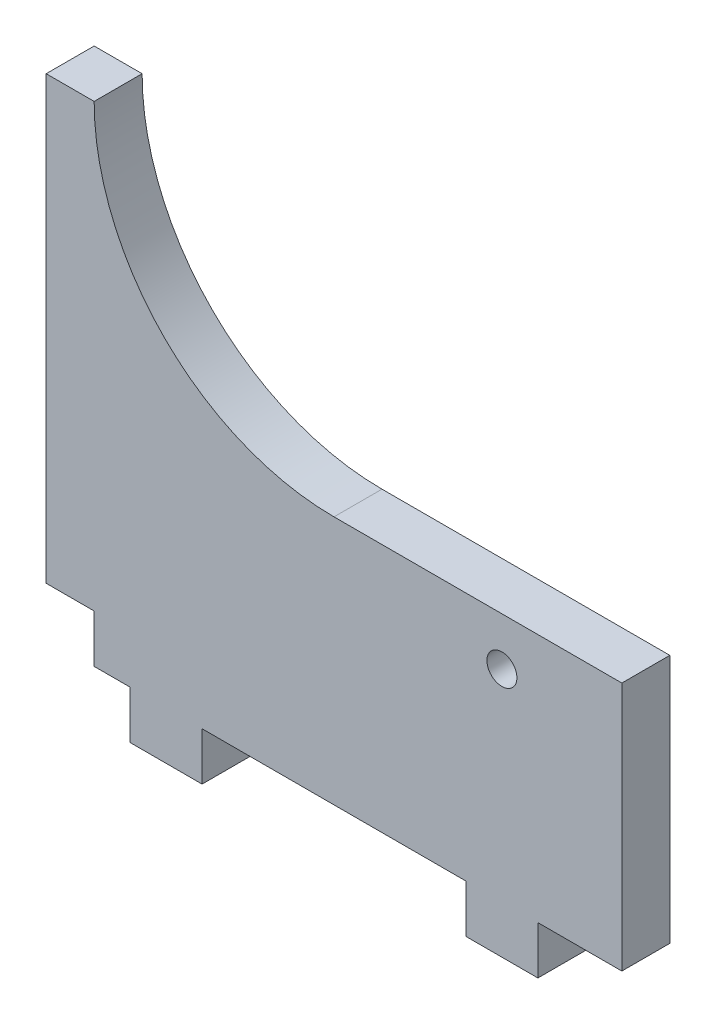
from build123d import *

# Parameters (mm, degrees)
EXTRUDE1_DEPTH     = 12.7
SKETCH2_R          = 3.96875
CUT_EXTRUDE1_DEPTH = 162.863978698
SKETCH3_W          = 12.7
SKETCH3_H          = 12.7
EXTRUDE2_DEPTH     = 162.863978698
SKETCH4_W          = 105.983052191
SKETCH4_H          = 75.202262717
EXTRUDE3_DEPTH     = 162.863978698


with BuildPart() as part:
    # Sketch1 → Extrude1 (new body)
    with BuildSketch(Plane.XY):
        with BuildLine():
            Line((-76.2, 12.7), (-53.975, 12.7))
            Line((-53.975, 12.7), (-53.975, 0))
            Line((-53.975, 0), (-34.925, 0))
            Line((-34.925, 0), (-34.925, 12.7))
            Line((-34.925, 12.7), (34.925, 12.7))
            Line((34.925, 12.7), (34.925, 0))
            Line((34.925, 0), (53.975, 0))
            Line((53.975, 0), (53.975, 12.7))
            Line((53.975, 12.7), (76.2, 12.7))
            Line((76.2, 12.7), (76.2, 142.24))
            Line((76.2, 142.24), (63.5, 142.24))
            ThreePointArc((63.5, 142.24), (0, 78.74), (-63.5, 142.24))
            Line((-63.5, 142.24), (-76.2, 142.24))
            Line((-76.2, 142.24), (-76.2, 12.7))
        make_face()
    extrude(amount=EXTRUDE1_DEPTH)

    # Sketch2 → Cut-Extrude1 (cut, through all)
    with BuildSketch(Plane.XY.offset(12.7)):
        with Locations((44.45, 66.04)):
            Circle(SKETCH2_R)
    extrude(amount=-CUT_EXTRUDE1_DEPTH, mode=Mode.SUBTRACT)

    # Sketch3 → Extrude2 (cut, through all)
    with BuildSketch(Plane.XY.offset(12.7)):
        with Locations((-69.85, 19.05)):
            Rectangle(SKETCH3_W, SKETCH3_H)
    extrude(amount=-EXTRUDE2_DEPTH, mode=Mode.SUBTRACT)

    # Sketch4 → Extrude3 (cut, through all)
    with BuildSketch(Plane.XY.offset(12.7)):
        with Locations((52.991526096, 116.341131359)):
            Rectangle(SKETCH4_W, SKETCH4_H)
    extrude(amount=-EXTRUDE3_DEPTH, mode=Mode.SUBTRACT)


solid = part.part
